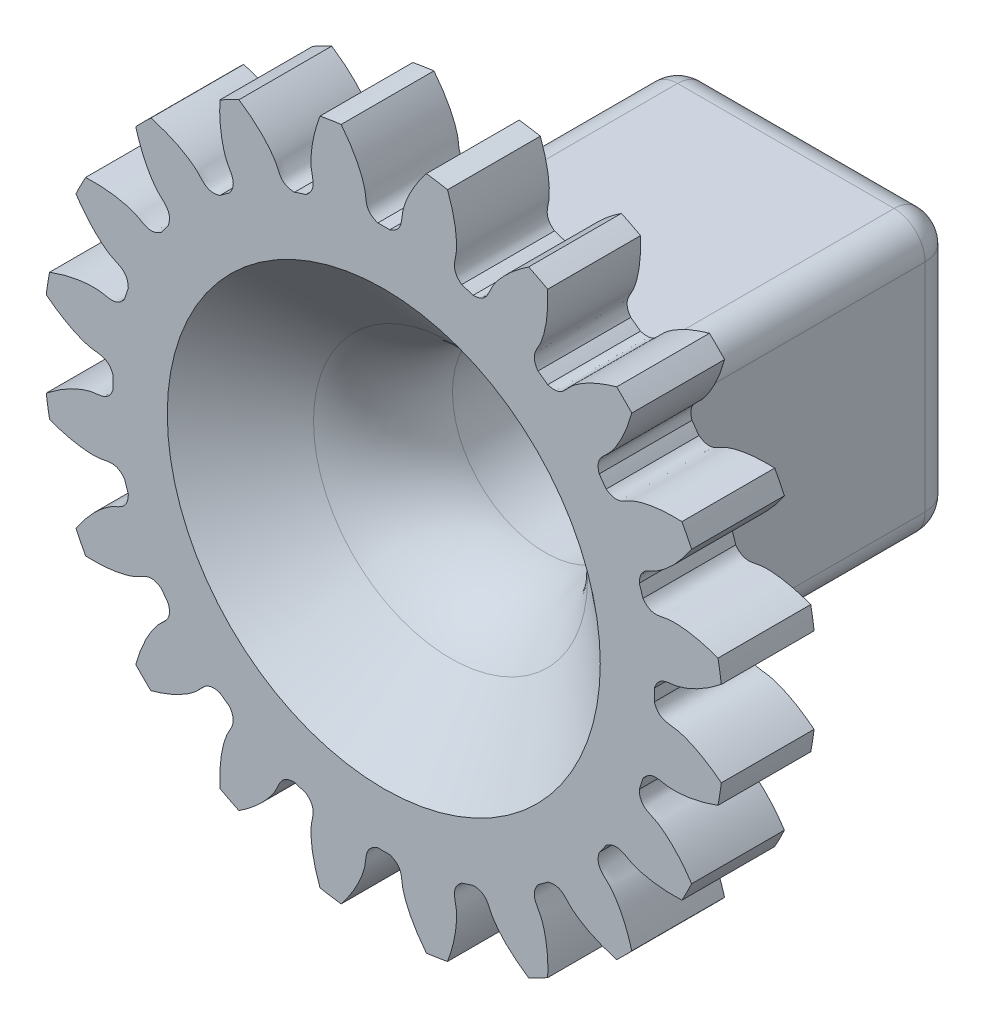
from build123d import *

# Parameters (mm, degrees)
SKETCH_1_R               = 11
EXTRUDE_1_DEPTH          = 3
CUT_EXTRUDE_1_DEPTH      = 16.842979518
PATTERN_CIRCULAR_1_COUNT = 20
SKETCH_4_R               = 3
CUT_EXTRUDE_2_DEPTH      = 10
EXTRUDE_START            = 11
SKETCH_5_W               = 9
SKETCH_5_H               = 9
SKETCH_5_R               = 3
EXTRUDE_2_DEPTH          = 11
EXTRUDE_START_2          = 1
SKETCH_6_R               = 6.5
SKETCH_6_R_2             = 3
EXTRUDE_3_DEPTH          = 1
CHAMFER_1_SIZE           = 4
CHAMFER_1_SIZE2          = 3.356398525
FILLET_1_R               = 4
FILLET_2_R               = 1
FILLET_3_R               = 1


with BuildPart() as part:
    # 草图1 → 凸台-拉伸1 (new body)
    with BuildSketch(Plane.XY):
        Circle(SKETCH_1_R)
    extrude(amount=EXTRUDE_1_DEPTH)

    # 草图2 → 切除-拉伸1 (cut, through all)
    with BuildSketch(Plane.XY):
        with BuildLine():
            ThreePointArc((0.1933166, 8.747864236), (0, 8.75), (-0.1933166, 8.747864236))
            add(Edge.make_bspline(
                [(-0.1933166, 8.747864236), (-0.611189405, 8.893475512), (-0.557084099, 9.187113699), (-0.612897056, 9.470009403), (-0.618892186, 9.497556614), (-0.62631089, 9.528634615), (-0.635292097, 9.563196836), (-0.64597914, 9.601191497), (-0.658512055, 9.642562828), (-0.673029871, 9.687250733), (-0.68966975, 9.735190947), (-0.7085671, 9.786315045), (-0.729855399, 9.840550501), (-0.753666102, 9.897820731), (-0.780128531, 9.958045151), (-0.809369765, 10.021139231), (-0.841514533, 10.087014551), (-0.876685117, 10.155578861), (-0.915001238, 10.22673615), (-0.956579966, 10.300386704), (-1.001535609, 10.376427181), (-1.049979626, 10.454750678), (-1.102020521, 10.535246805), (-1.157763756, 10.617801764), (-1.217311651, 10.70229842), (-1.280763301, 10.78861639), (-1.34821448, 10.876632121), (-1.419757562, 10.966218973), (-1.495481426, 11.057247311), (-1.575471385, 11.149584594), (-1.659809097, 11.243095463), (-1.748572489, 11.337641835), (-1.841835684, 11.433083002), (-1.939668926, 11.529275727), (-2.042138506, 11.626074339), (-2.149306698, 11.723330842), (-2.261231689, 11.820895011), (-2.377967518, 11.918614499), (-2.499564012, 12.016334946), (-2.626066734, 12.113900082), (-2.757516899, 12.21115184), (-2.941473591, 12.341639868), (-3.083932413, 12.436332601), (-3.181157982, 12.49825186)],
                knots=[0, 0, 0, 0, 0.165916003, 0.170905922, 0.176663519, 0.183188797, 0.190481754, 0.198542391, 0.207370708, 0.216966704, 0.22733038, 0.238461736, 0.250360771, 0.263027487, 0.276461881, 0.290663956, 0.30563371, 0.321371144, 0.337876258, 0.355149051, 0.373189524, 0.391997677, 0.411573509, 0.431917021, 0.453028213, 0.474907084, 0.497553636, 0.520967867, 0.545149777, 0.570099367, 0.595816637, 0.622301587, 0.649554216, 0.677574526, 0.706362514, 0.735918183, 0.766241531, 0.797332559, 0.829191267, 0.861817654, 0.895211721, 0.929373468, 1, 1, 1, 1], degree=3))
            ThreePointArc((-3.181157982, 12.49825186), (0, 12.89674632), (3.181157982, 12.49825186))
            add(Edge.make_bspline(
                [(0.1933166, 8.747864236), (0.611189405, 8.893475512), (0.557084099, 9.187113699), (0.612897056, 9.470009403), (0.618892186, 9.497556614), (0.62631089, 9.528634615), (0.635292097, 9.563196836), (0.64597914, 9.601191497), (0.658512055, 9.642562828), (0.673029871, 9.687250733), (0.68966975, 9.735190947), (0.7085671, 9.786315045), (0.729855399, 9.840550501), (0.753666102, 9.897820731), (0.780128531, 9.958045151), (0.809369765, 10.021139231), (0.841514533, 10.087014551), (0.876685117, 10.155578861), (0.915001238, 10.22673615), (0.956579966, 10.300386704), (1.001535609, 10.376427181), (1.049979626, 10.454750678), (1.102020521, 10.535246805), (1.157763756, 10.617801764), (1.217311651, 10.70229842), (1.280763301, 10.78861639), (1.34821448, 10.876632121), (1.419757562, 10.966218973), (1.495481426, 11.057247311), (1.575471385, 11.149584594), (1.659809097, 11.243095463), (1.748572489, 11.337641835), (1.841835684, 11.433083002), (1.939668926, 11.529275727), (2.042138506, 11.626074339), (2.149306698, 11.723330842), (2.261231689, 11.820895011), (2.377967518, 11.918614499), (2.499564012, 12.016334946), (2.626066734, 12.113900082), (2.757516899, 12.21115184), (2.941473591, 12.341639868), (3.083932413, 12.436332601), (3.181157982, 12.49825186)],
                knots=[0, 0, 0, 0, 0.165916003, 0.170905922, 0.176663519, 0.183188797, 0.190481754, 0.198542391, 0.207370708, 0.216966704, 0.22733038, 0.238461736, 0.250360771, 0.263027487, 0.276461881, 0.290663956, 0.30563371, 0.321371144, 0.337876258, 0.355149051, 0.373189524, 0.391997677, 0.411573509, 0.431917021, 0.453028213, 0.474907084, 0.497553636, 0.520967867, 0.545149777, 0.570099367, 0.595816637, 0.622301587, 0.649554216, 0.677574526, 0.706362514, 0.735918183, 0.766241531, 0.797332559, 0.829191267, 0.861817654, 0.895211721, 0.929373468, 1, 1, 1, 1], degree=3))
        make_face()
    cut_extrude_1 = extrude(amount=CUT_EXTRUDE_1_DEPTH, mode=Mode.SUBTRACT)

    # 阵列(圆周)1: 切除-拉伸1 ×20 about axis
    pattern_circular_1_axis = Axis((0, 0, -1.5), (0, 0, 1))
    for i in range(1, PATTERN_CIRCULAR_1_COUNT):
        add(cut_extrude_1.rotate(pattern_circular_1_axis, i * 360 / PATTERN_CIRCULAR_1_COUNT), mode=Mode.SUBTRACT)

    # 草图4 → 切除-拉伸2 (cut)
    with BuildSketch(Plane(origin=(0, 0, 0), x_dir=(-1, 0, 0), z_dir=(0, 0, -1))):
        Circle(SKETCH_4_R)
    extrude(amount=-CUT_EXTRUDE_2_DEPTH, mode=Mode.SUBTRACT)

    # 草图5 → 凸台-拉伸2 (add)
    with BuildSketch(Plane(origin=(0, 0, 0), x_dir=(-1, 0, 0), z_dir=(0, 0, -1)).offset(EXTRUDE_START)):
        Rectangle(SKETCH_5_W, SKETCH_5_H)
        Circle(SKETCH_5_R, mode=Mode.SUBTRACT)
    extrude(amount=-EXTRUDE_2_DEPTH)

    # 草图6 → 凸台-拉伸3 (add)
    with BuildSketch(Plane(origin=(0, 0, 0), x_dir=(-1, 0, 0), z_dir=(0, 0, -1)).offset(EXTRUDE_START_2)):
        Circle(SKETCH_6_R)
        Circle(SKETCH_6_R_2, mode=Mode.SUBTRACT)
    extrude(amount=-EXTRUDE_3_DEPTH)

    # 倒角1
    chamfer_1_edges = [part.edges().sort_by_distance(p)[0] for p in [
        (3, 0, 3),
    ]]
    chamfer_1_side = [part.faces().sort_by_distance(p)[0] for p in [
        (-1.0104753, 9.710458868, 3),
    ]]
    chamfer(chamfer_1_edges, length=CHAMFER_1_SIZE, length2=CHAMFER_1_SIZE2, reference=chamfer_1_side[0])

    # 圆角1
    fillet_1_edges = [part.edges().sort_by_distance(p)[0] for p in [
        (3, 0, -0.356398525),
    ]]
    fillet(fillet_1_edges, radius=FILLET_1_R)

    # 圆角2
    fillet_2_edges = [part.edges().sort_by_distance(p)[0] for p in [
        (-4.5, -4.5, -6),
        (4.5, -4.5, -6),
        (-4.5, 4.5, -6),
        (4.5, 4.5, -6),
    ]]
    fillet(fillet_2_edges, radius=FILLET_2_R)

    # 圆角3
    fillet_3_edges = [part.edges().sort_by_distance(p)[0] for p in [
        (4.207106781, 4.207106781, -11),
        (0, 4.5, -11),
        (-4.207106781, 4.207106781, -11),
        (-4.5, 0, -11),
        (-4.207106781, -4.207106781, -11),
        (0, -4.5, -11),
        (4.207106781, -4.207106781, -11),
        (4.5, 0, -11),
    ]]
    fillet(fillet_3_edges, radius=FILLET_3_R)


solid = part.part
